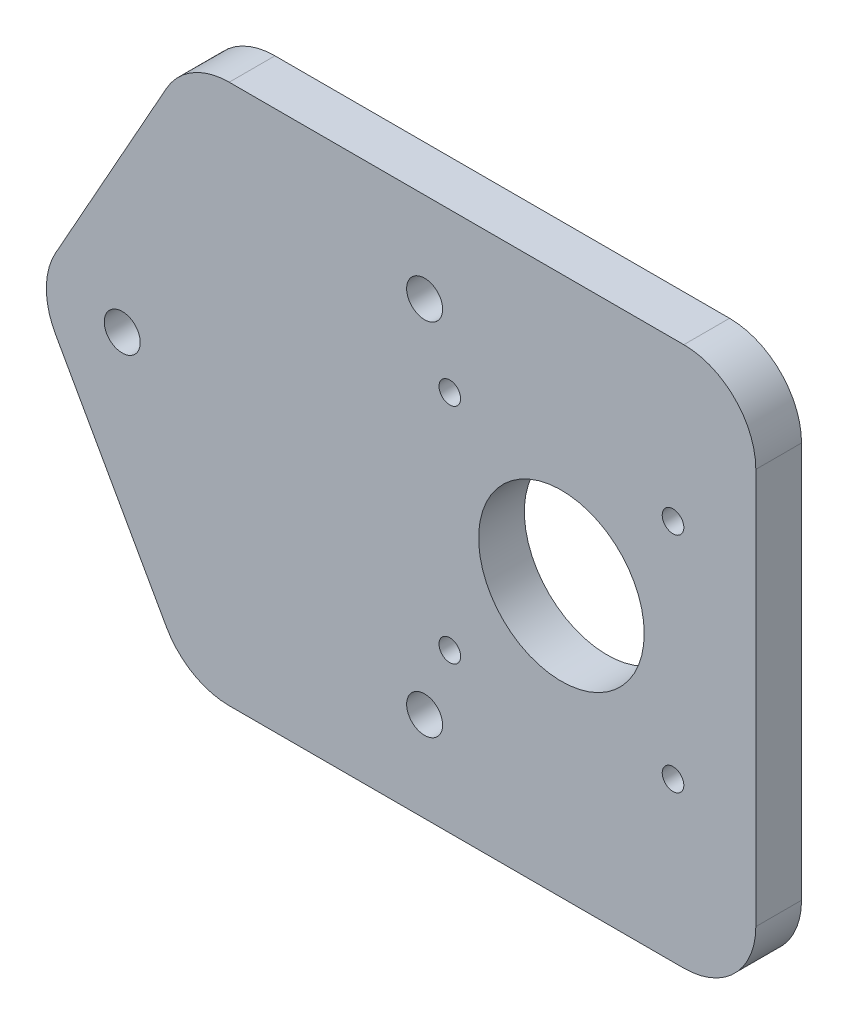
from build123d import *

# Parameters (mm, degrees)
SKETCH1_W             = 100
SKETCH1_H             = 75
PLATE_DEPTH           = 6.35
SKETCH2_R             = 2.5
CUT_IDLER_HOLES_DEPTH = 126.161186076
SKETCH3_R             = 1.5
SKETCH3_R_2           = 11.5
CUT_MOTOR_HOLES_DEPTH = 126.161186076
CHAMFER1_SIZE         = 1.5
FILLET1_R             = 10
CUT_EXTRUDE1_DEPTH    = 6.35
FILLET5_R             = 10


with BuildPart() as part:
    # Sketch1 → plate (new body)
    with BuildSketch(Plane.XY):
        with Locations((50, 37.5)):
            Rectangle(SKETCH1_W, SKETCH1_H)
    extrude(amount=PLATE_DEPTH)

    # Sketch2 → cut idler holes (cut, through all)
    with BuildSketch(Plane.XY.offset(6.35)):
        with Locations((54, 62.5)):
            Circle(SKETCH2_R)
        with Locations((12, 37.5)):
            Circle(SKETCH2_R)
        with Locations((54, 12.5)):
            Circle(SKETCH2_R)
    extrude(amount=-CUT_IDLER_HOLES_DEPTH, mode=Mode.SUBTRACT)

    # Sketch3 → cut motor holes (cut, through all)
    with BuildSketch(Plane.XY.offset(6.35)):
        with Locations((57.5, 53)):
            Circle(SKETCH3_R)
        with Locations((88.5, 53)):
            Circle(SKETCH3_R)
        with Locations((88.5, 22)):
            Circle(SKETCH3_R)
        with Locations((57.5, 22)):
            Circle(SKETCH3_R)
        with Locations((73, 37.5)):
            Circle(SKETCH3_R_2)
    extrude(amount=-CUT_MOTOR_HOLES_DEPTH, mode=Mode.SUBTRACT)

    # Chamfer1
    chamfer1_edges = [part.edges().sort_by_distance(p)[0] for p in [
        (56, 53, 0),
        (87, 22, 0),
        (56, 22, 0),
        (87, 53, 0),
    ]]
    chamfer(chamfer1_edges, length=CHAMFER1_SIZE)

    # Fillet1
    fillet1_edges = [part.edges().sort_by_distance(p)[0] for p in [
        (0, 75, 3.175),
        (100, 75, 3.175),
        (100, 0, 3.175),
        (0, 0, 3.175),
    ]]
    fillet(fillet1_edges, radius=FILLET1_R)

    # Sketch4 → Cut-Extrude1 (cut)
    with BuildSketch(Plane.XY.offset(6.35)):
        with BuildLine():
            Line((10, 0), (21, 0))
            Line((21, 0), (0, 37.5))
            Line((0, 37.5), (0, 10))
            ThreePointArc((0, 10), (2.928932188, 2.928932188), (10, 0))
        make_face()
    cut_extrude1 = extrude(amount=-CUT_EXTRUDE1_DEPTH, mode=Mode.SUBTRACT)

    # Mirror2: Cut-Extrude1 across plane
    add(cut_extrude1.mirror(Plane(origin=(0, 37.5, 0), x_dir=(0, 0, 1), z_dir=(0, -1, 0))), mode=Mode.SUBTRACT)

    # Fillet5
    fillet5_edges = [part.edges().sort_by_distance(p)[0] for p in [
        (21, 75, 3.175),
        (0, 37.5, 3.175),
        (21, 0, 3.175),
    ]]
    fillet(fillet5_edges, radius=FILLET5_R)


solid = part.part
